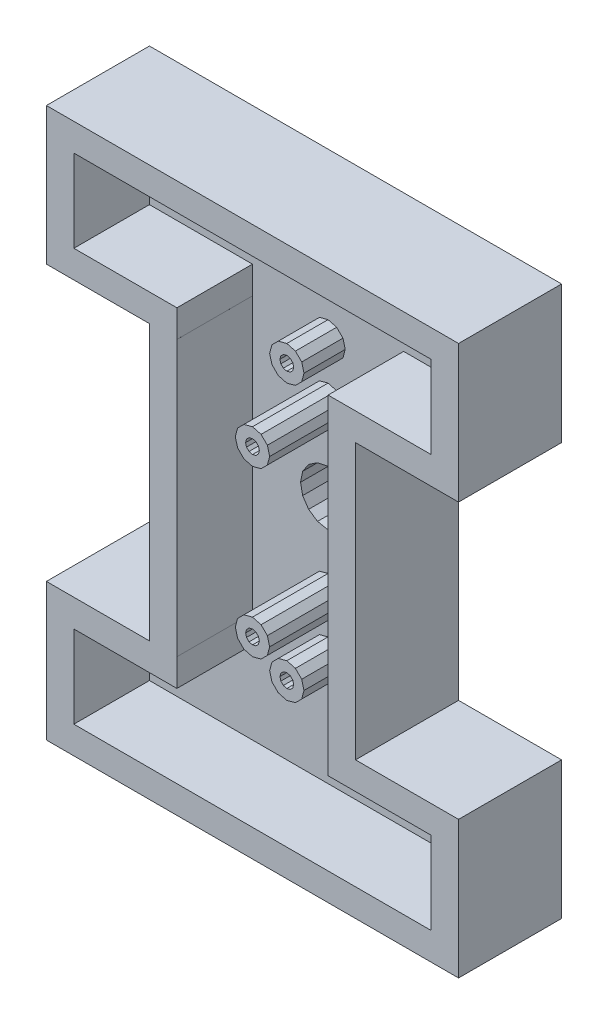
from build123d import *

# Parameters (mm, degrees)
SKETCH1_W           = 60.000998497
SKETCH1_H           = 80.001998902
BOSS_EXTRUDE1_DEPTH = 15.001
SKETCH2_W           = 14.999998093
SKETCH2_H           = 39.998000621
CUT_EXTRUDE1_DEPTH  = 80.035391071
SKETCH3_W           = 14.99999988
SKETCH3_H           = 39.998000621
CUT_EXTRUDE2_DEPTH  = 80.035391071
CUT_EXTRUDE3_DEPTH  = 11.003000021
BOSS_EXTRUDE2_DEPTH = 6.004000425
CUT_EXTRUDE4_DEPTH  = 80.035391071
CUT_EXTRUDE5_DEPTH  = 80.035391071
BOSS_EXTRUDE3_DEPTH = 6.004000425
CUT_EXTRUDE6_DEPTH  = 80.035391071
BOSS_EXTRUDE4_DEPTH = 11.003000021
CUT_EXTRUDE7_DEPTH  = 11.003000021
BOSS_EXTRUDE5_DEPTH = 11.003000021
CUT_EXTRUDE8_DEPTH  = 11.003000021


with BuildPart() as part:
    # Sketch1 → Boss-Extrude1 (new body)
    with BuildSketch(Plane.XY.offset(15)):
        with Locations((16.328499318, 22.25)):
            Rectangle(SKETCH1_W, SKETCH1_H)
    extrude(amount=-BOSS_EXTRUDE1_DEPTH)

    # Sketch2 → Cut-Extrude1 (cut, through all)
    with BuildSketch(Plane(origin=(0, 0, -0.001), x_dir=(-1, 0, 0), z_dir=(0, 0, -1))):
        with Locations((-38.82899952, 22.250000239)):
            Rectangle(SKETCH2_W, SKETCH2_H)
    extrude(amount=-CUT_EXTRUDE1_DEPTH, mode=Mode.SUBTRACT)

    # Sketch3 → Cut-Extrude2 (cut, through all)
    with BuildSketch(Plane(origin=(0, 0, -0.001), x_dir=(-1, 0, 0), z_dir=(0, 0, -1))):
        with Locations((6.171999991, 22.250000239)):
            Rectangle(SKETCH3_W, SKETCH3_H)
    extrude(amount=-CUT_EXTRUDE2_DEPTH, mode=Mode.SUBTRACT)

    # Sketch4 → Cut-Extrude3 (cut)
    with BuildSketch(Plane.XY.offset(15)):
        Polygon((27.332000732, 42.25), (27.332000732, 46.247001648), (42.331001282, 46.247001648), (42.331001282, 58.252998352), (-9.673999786, 58.252998352), (-9.673999786, 46.247001648), (5.324999809, 46.247001648), (5.324999809, 42.25), (5.326000214, 42.25), (5.326000214, 2.249000072), (5.324999809, 2.249000072), (5.324999809, -1.746999979), (-9.673999786, -1.746999979), (-9.673999786, -13.753000259), (42.331001282, -13.753000259), (42.331001282, -1.746999979), (27.332000732, -1.746999979), (27.332000732, 2.249000072), (27.330999374, 2.249000072), (27.330999374, 42.25), align=None)
    extrude(amount=-CUT_EXTRUDE3_DEPTH, mode=Mode.SUBTRACT)

    # Sketch5 → Boss-Extrude2 (add)
    with BuildSketch(Plane.XY.offset(3.996999979)):
        Polygon((16.327999115, 4.750999928), (17.579000473, 4.414999962), (18.493999481, 3.5), (18.829000473, 2.25), (18.493999481, 1), (17.579000473, 0.085000001), (16.327999115, -0.25), (15.078000069, 0.085000001), (14.163000107, 1), (13.828000069, 2.25), (14.163000107, 3.5), (15.078000069, 4.414999962), align=None)
    extrude(amount=BOSS_EXTRUDE2_DEPTH)

    # Sketch6 → Cut-Extrude4 (cut, through all)
    with BuildSketch(Plane(origin=(0, 0, -0.001), x_dir=(-1, 0, 0), z_dir=(0, 0, -1))):
        Polygon((-16.829999924, 3.114000082), (-17.197000504, 2.747999907), (-17.330999374, 2.247999907), (-17.197000504, 1.746999979), (-16.829999924, 1.381000042), (-16.327999115, 1.246999979), (-15.826999664, 1.381000042), (-15.460000038, 1.746999979), (-15.324999809, 2.247999907), (-15.460000038, 2.747999907), (-15.826999664, 3.114000082), (-16.327999115, 3.247999907), align=None)
    extrude(amount=-CUT_EXTRUDE4_DEPTH, mode=Mode.SUBTRACT)

    # Sketch7 → Cut-Extrude5 (cut, through all)
    with BuildSketch(Plane(origin=(0, 0, -0.001), x_dir=(-1, 0, 0), z_dir=(0, 0, -1))):
        Polygon((-13.498000145, 19.419000626), (-12.630000114, 20.718000412), (-12.324999809, 22.25), (-12.630000114, 23.781999588), (-13.498000145, 25.080999374), (-14.796999931, 25.947999954), (-16.327999115, 26.253000259), (-17.86000061, 25.947999954), (-19.159000397, 25.080999374), (-20.027000427, 23.781999588), (-20.330999374, 22.25), (-20.027000427, 20.718000412), (-19.159000397, 19.419000626), (-17.86000061, 18.552000046), (-16.327999115, 18.246999741), (-14.796999931, 18.552000046), align=None)
    extrude(amount=-CUT_EXTRUDE5_DEPTH, mode=Mode.SUBTRACT)

    # Sketch8 → Boss-Extrude3 (add)
    with BuildSketch(Plane.XY.offset(3.996999979)):
        Polygon((15.078000069, 40.084999084), (14.163000107, 41), (13.828000069, 42.25), (14.163000107, 43.5), (15.078000069, 44.415000916), (16.327999115, 44.750999451), (17.579000473, 44.415000916), (18.493999481, 43.5), (18.829000473, 42.25), (18.493999481, 41), (17.579000473, 40.084999084), (16.327999115, 39.75), align=None)
    extrude(amount=BOSS_EXTRUDE3_DEPTH)

    # Sketch9 → Cut-Extrude6 (cut, through all)
    with BuildSketch(Plane(origin=(0, 0, -0.001), x_dir=(-1, 0, 0), z_dir=(0, 0, -1))):
        Polygon((-15.826999664, 41.386001587), (-15.460000038, 41.751998901), (-15.324999809, 42.251998901), (-15.460000038, 42.752998352), (-15.826999664, 43.118999481), (-16.327999115, 43.252998352), (-16.829999924, 43.118999481), (-17.197000504, 42.752998352), (-17.330999374, 42.251998901), (-17.197000504, 41.751998901), (-16.829999924, 41.386001587), (-16.327999115, 41.251998901), align=None)
    extrude(amount=-CUT_EXTRUDE6_DEPTH, mode=Mode.SUBTRACT)

    # Sketch10 → Boss-Extrude4 (add)
    with BuildSketch(Plane.XY.offset(3.996999979)):
        Polygon((14.163000107, 9), (13.828000069, 10.25), (14.163000107, 11.5), (15.078000069, 12.414999962), (16.327999115, 12.75), (17.579000473, 12.414999962), (18.493999481, 11.5), (18.829000473, 10.25), (18.493999481, 9), (17.579000473, 8.085000038), (16.327999115, 7.75), (15.078000069, 8.085000038), align=None)
    extrude(amount=BOSS_EXTRUDE4_DEPTH)

    # Sketch11 → Cut-Extrude7 (cut)
    with BuildSketch(Plane.XY.offset(15)):
        Polygon((16.829999924, 9.380999565), (17.197000504, 9.748000145), (17.330999374, 10.25), (17.197000504, 10.751999855), (16.829999924, 11.119000435), (16.327999115, 11.253000259), (15.826999664, 11.119000435), (15.460000038, 10.751999855), (15.324999809, 10.25), (15.460000038, 9.748000145), (15.826999664, 9.380999565), (16.327999115, 9.246999741), align=None)
    extrude(amount=-CUT_EXTRUDE7_DEPTH, mode=Mode.SUBTRACT)

    # Sketch12 → Boss-Extrude5 (add)
    with BuildSketch(Plane.XY.offset(3.996999979)):
        Polygon((17.579000473, 36.415000916), (18.493999481, 35.5), (18.829000473, 34.25), (18.493999481, 33), (17.579000473, 32.084999084), (16.327999115, 31.75), (15.078000069, 32.084999084), (14.163000107, 33), (13.828000069, 34.25), (14.163000107, 35.5), (15.078000069, 36.415000916), (16.327999115, 36.750999451), align=None)
    extrude(amount=BOSS_EXTRUDE5_DEPTH)

    # Sketch13 → Cut-Extrude8 (cut)
    with BuildSketch(Plane.XY.offset(15)):
        Polygon((15.826999664, 35.118999481), (15.460000038, 34.751998901), (15.324999809, 34.25), (15.460000038, 33.748001099), (15.826999664, 33.381000519), (16.327999115, 33.247001648), (16.829999924, 33.381000519), (17.197000504, 33.748001099), (17.330999374, 34.25), (17.197000504, 34.751998901), (16.829999924, 35.118999481), (16.327999115, 35.252998352), align=None)
    extrude(amount=-CUT_EXTRUDE8_DEPTH, mode=Mode.SUBTRACT)


solid = part.part
